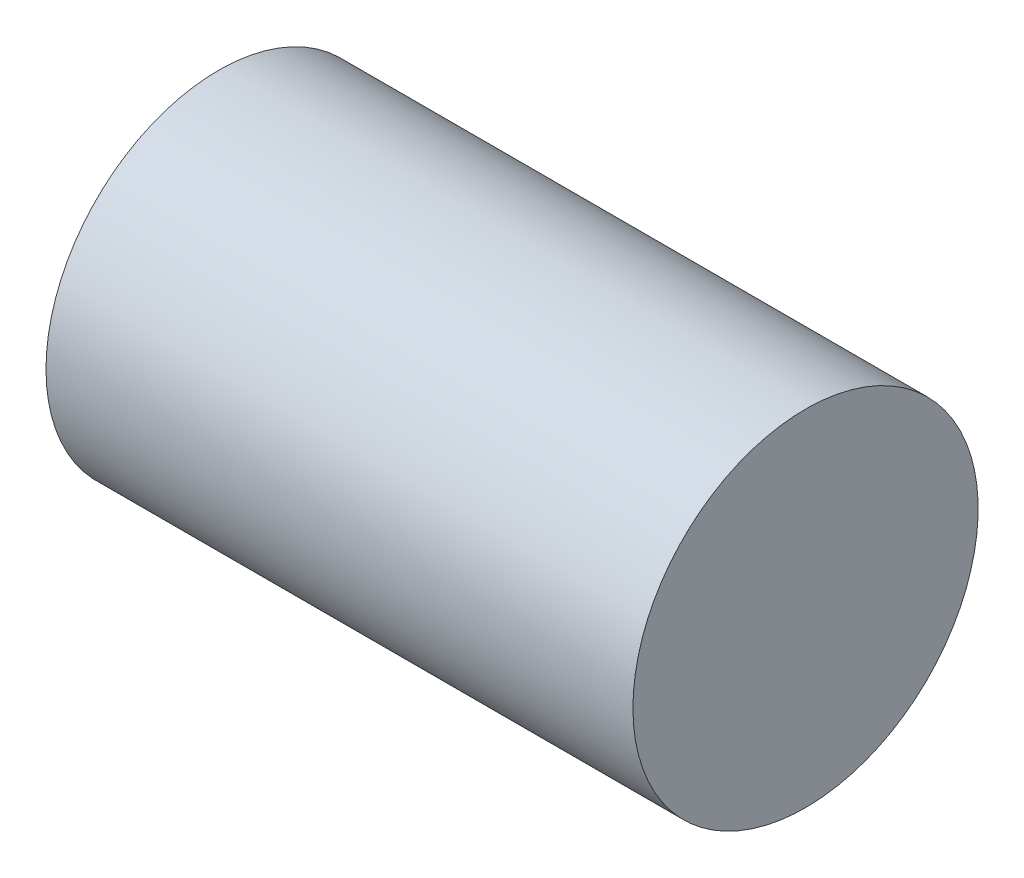
from build123d import *

# Parameters (mm, degrees)
SKETCH2_W = 4.08
SKETCH2_H = 1.2


with BuildPart() as part:
    # Sketch2 → Revolve1 (revolve)
    with BuildSketch(Plane.XY, mode=Mode.PRIVATE) as revolve1_sk:
        with Locations((-7.115905512, 0.6)):
            Rectangle(SKETCH2_W, SKETCH2_H)
    revolve(revolve1_sk.sketch.rotate(Axis((-9.155905512, 0, 0), (1, 0, 0)), 90), axis=Axis((-9.155905512, 0, 0), (1, 0, 0)))


solid = part.part
